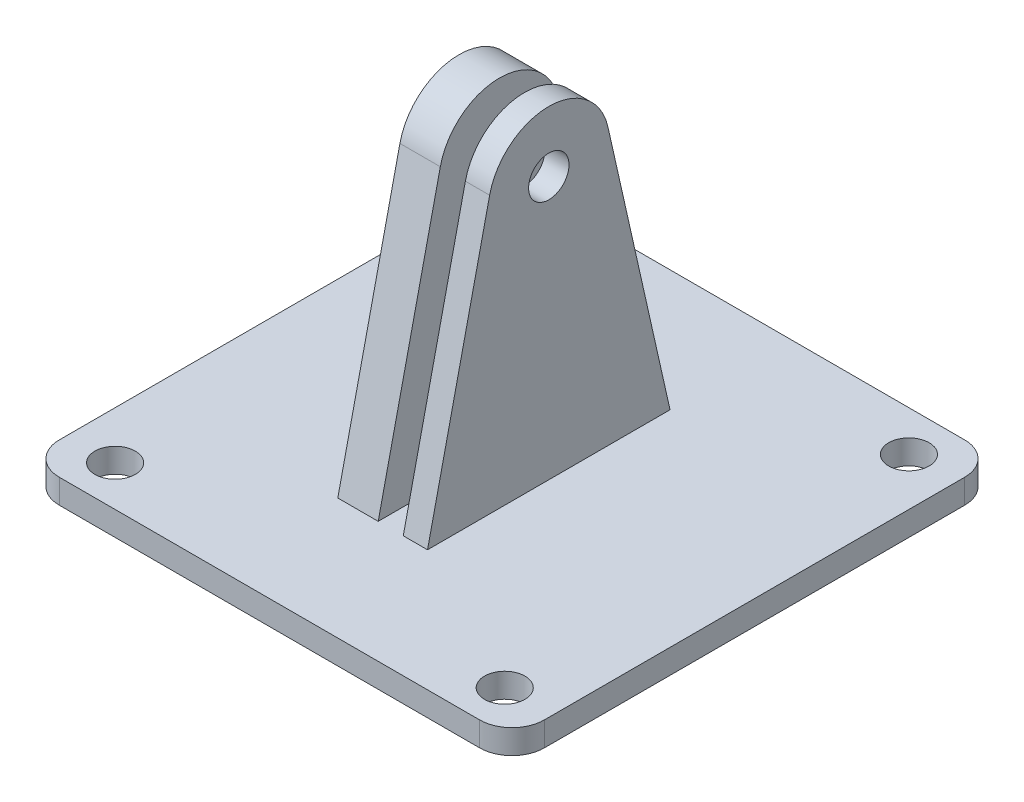
from build123d import *

# Parameters (mm, degrees)
SKETCH2_R           = 2.5
BOSS_EXTRUDE1_DEPTH = 3
SKETCH3_W           = 30
SKETCH3_H           = 30
BOSS_EXTRUDE2_DEPTH = 40
CUT_EXTRUDE2_DEPTH  = 30
CUT_EXTRUDE3_DEPTH  = 30
SKETCH12_W          = 3.1
SKETCH12_H          = 30
SKETCH12_W_2        = 8.45
SKETCH12_W_3        = 10.45
CUT_EXTRUDE4_DEPTH  = 20
SKETCH13_R          = 2.5
CUT_EXTRUDE5_DEPTH  = 15
CUT_EXTRUDE6_DEPTH  = 3


with BuildPart() as part:
    # Sketch2 → Boss-Extrude1 (new body)
    with BuildSketch(Plane(origin=(0, 0, 0), x_dir=(1, 0, 0), z_dir=(0, 1, 0))):
        with BuildLine():
            Line((-26, -30), (26, -30))
            ThreePointArc((26, -30), (28.828427125, -28.828427125), (30, -26))
            Line((30, -26), (30, 26))
            ThreePointArc((30, 26), (28.828427125, 28.828427125), (26, 30))
            Line((26, 30), (-26, 30))
            ThreePointArc((-26, 30), (-28.828427125, 28.828427125), (-30, 26))
            Line((-30, 26), (-30, -26))
            ThreePointArc((-30, -26), (-28.828427125, -28.828427125), (-26, -30))
        make_face()
        with Locations(Location((-24.1, 25, 0), (0, 0, 270))):
            Circle(SKETCH2_R, mode=Mode.SUBTRACT)
        with Locations(Location((24.1, 25, 0), (0, 0, 270))):
            Circle(SKETCH2_R, mode=Mode.SUBTRACT)
        with Locations(Location((-24.1, -25, 0), (0, 0, 270))):
            Circle(SKETCH2_R, mode=Mode.SUBTRACT)
        with Locations(Location((24.1, -25, 0), (0, 0, 270))):
            Circle(SKETCH2_R, mode=Mode.SUBTRACT)
    extrude(amount=BOSS_EXTRUDE1_DEPTH)

    # Sketch3 → Boss-Extrude2 (add)
    with BuildSketch(Plane(origin=(0, 3, 0), x_dir=(1, 0, 0), z_dir=(0, 1, 0))):
        Rectangle(SKETCH3_W, SKETCH3_H)
    extrude(amount=BOSS_EXTRUDE2_DEPTH)

    # Sketch8 → Cut-Extrude2 (cut)
    with BuildSketch(Plane(origin=(15, 0, 0), x_dir=(0, 0, -1), z_dir=(1, 0, 0))):
        with BuildLine():
            Line((-7.317073171, 37.146341463), (-15, 3))
            Line((-15, 3), (-15, 43))
            Line((-15, 43), (0, 43))
            ThreePointArc((0, 43), (-4.685212857, 41.356516071), (-7.317073171, 37.146341463))
        make_face()
    extrude(amount=-CUT_EXTRUDE2_DEPTH, mode=Mode.SUBTRACT)

    # Sketch10 → Cut-Extrude3 (cut)
    with BuildSketch(Plane(origin=(15, 0, 0), x_dir=(0, 0, -1), z_dir=(1, 0, 0))):
        with BuildLine():
            Line((7.317073171, 37.146341463), (15, 3))
            Line((15, 3), (15, 43))
            Line((15, 43), (0, 43))
            ThreePointArc((0, 43), (4.685212857, 41.356516071), (7.317073171, 37.146341463))
        make_face()
    extrude(amount=-CUT_EXTRUDE3_DEPTH, mode=Mode.SUBTRACT)

    # Sketch12 → Cut-Extrude4 (cut, symmetric)
    with BuildSketch(Plane(origin=(0, 23, 0), x_dir=(1, 0, 0), z_dir=(0, 1, 0))):
        Rectangle(SKETCH12_W, SKETCH12_H)
        with Locations((-10.775, 0)):
            Rectangle(SKETCH12_W_2, SKETCH12_H)
        with Locations((9.775, 0)):
            Rectangle(SKETCH12_W_3, SKETCH12_H)
    extrude(amount=CUT_EXTRUDE4_DEPTH, both=True, mode=Mode.SUBTRACT)

    # Sketch13 → Cut-Extrude5 (cut, symmetric)
    with BuildSketch(Plane(origin=(0, 0, 0), x_dir=(0, 0, -1), z_dir=(1, 0, 0))):
        with Locations((0, 35.5)):
            Circle(SKETCH13_R)
    extrude(amount=CUT_EXTRUDE5_DEPTH, both=True, mode=Mode.SUBTRACT)

    # Sketch14 → Cut-Extrude6 (cut)
    with BuildSketch(Plane.ZY.offset(6.55)):
        Polygon((-3.507402885, 37.525), (-3.507402885, 33.475), (0, 31.45), (3.507402885, 33.475), (3.507402885, 37.525), (0, 39.55), align=None)
    extrude(amount=-CUT_EXTRUDE6_DEPTH, mode=Mode.SUBTRACT)


solid = part.part
